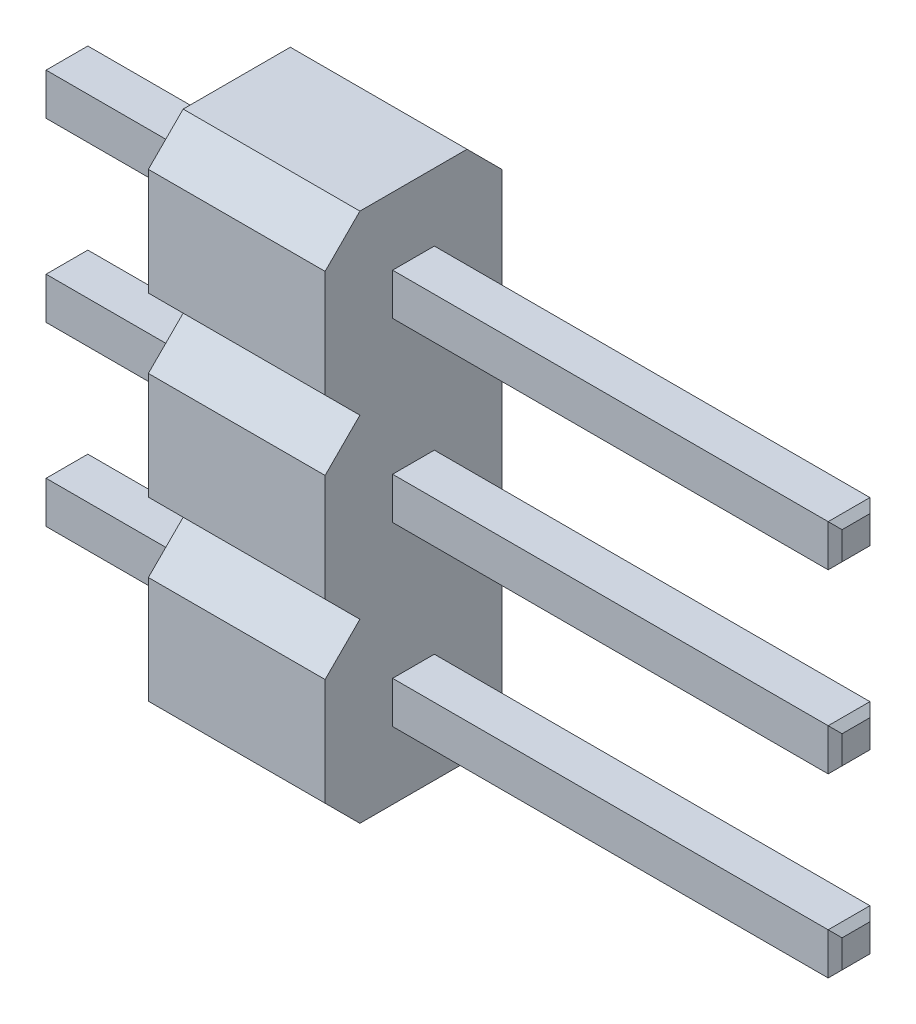
from build123d import *

# Parameters (mm, degrees)
PLASTIC_DEPTH   = 2.54
SKETCH2_W       = 11.44
SKETCH2_H       = 0.6
CONTACT_DEPTH   = 0.3
CHAMFER1_SIZE   = 0.1
LPATTERN1_COUNT = 3
LPATTERN1_PITCH = 2.54


with BuildPart() as part:
    # Sketch1 → Plastic (new body)
    with BuildSketch(Plane(origin=(0, 0, 0), x_dir=(0, 0, -1), z_dir=(1, 0, 0))):
        Polygon((-2.04, 1.27), (-0.5, 1.27), (0, 0.77), (0, -0.77), (-0.5, -1.27), (-2.04, -1.27), (-2.54, -0.77), (-2.54, 0.77), align=None)
    extrude(amount=PLASTIC_DEPTH)

    # Sketch2 → Contact (add, symmetric)
    with BuildSketch(Plane(origin=(0, 0, 0), x_dir=(1, 0, 0), z_dir=(0, 1, 0))):
        with Locations((3.18, -1.27)):
            Rectangle(SKETCH2_W, SKETCH2_H)
    extrude(amount=CONTACT_DEPTH, both=True)

    # Chamfer1
    chamfer1_edges = [part.edges().sort_by_distance(p)[0] for p in [
        (8.9, 0, 0.97),
        (8.9, 0.3, 1.27),
        (-2.54, 0, 1.57),
        (8.9, -0.3, 1.27),
        (8.9, 0, 1.57),
        (-2.54, -0.3, 1.27),
        (-2.54, 0, 0.97),
        (-2.54, 0.3, 1.27),
    ]]
    chamfer(chamfer1_edges, length=CHAMFER1_SIZE)

    # LPattern1: part ×3


with BuildPart() as part_1:
    add(part.part)
    with Locations(*[(0, i * LPATTERN1_PITCH, 0) for i in range(1, LPATTERN1_COUNT)]):
        add(part.part)


solid = part_1.part
